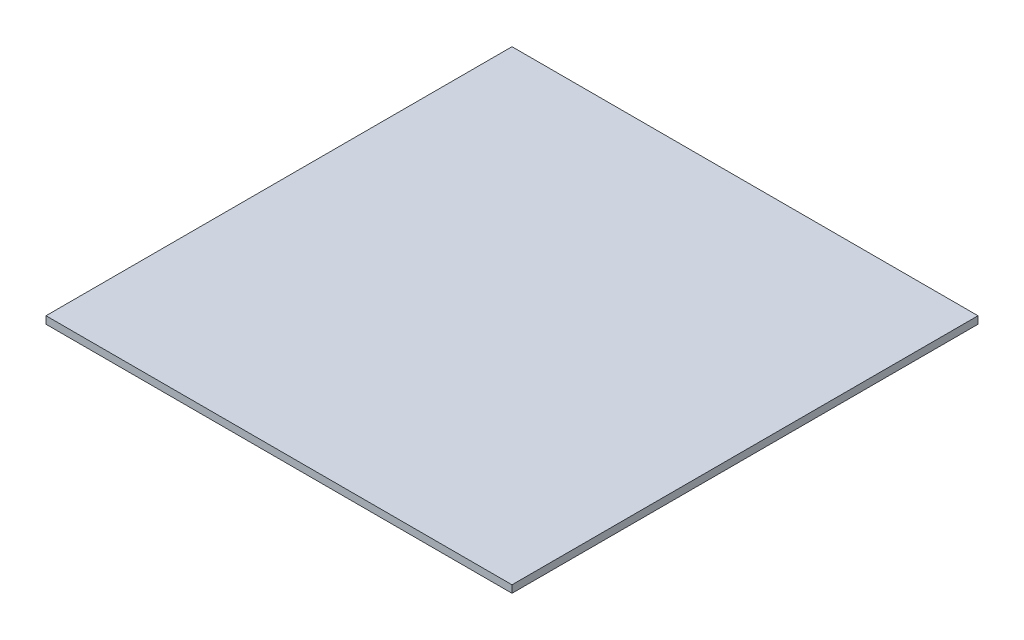
from build123d import *

# Parameters (mm, degrees)
SKETCH1_W           = 200
SKETCH1_H           = 200
BOSS_EXTRUDE1_DEPTH = 3.175


with BuildPart() as part:
    # Sketch1 → Boss-Extrude1 (new body)
    with BuildSketch(Plane(origin=(0, 0, 0), x_dir=(1, 0, 0), z_dir=(0, 1, 0))):
        Rectangle(SKETCH1_W, SKETCH1_H)
    extrude(amount=BOSS_EXTRUDE1_DEPTH)


solid = part.part
